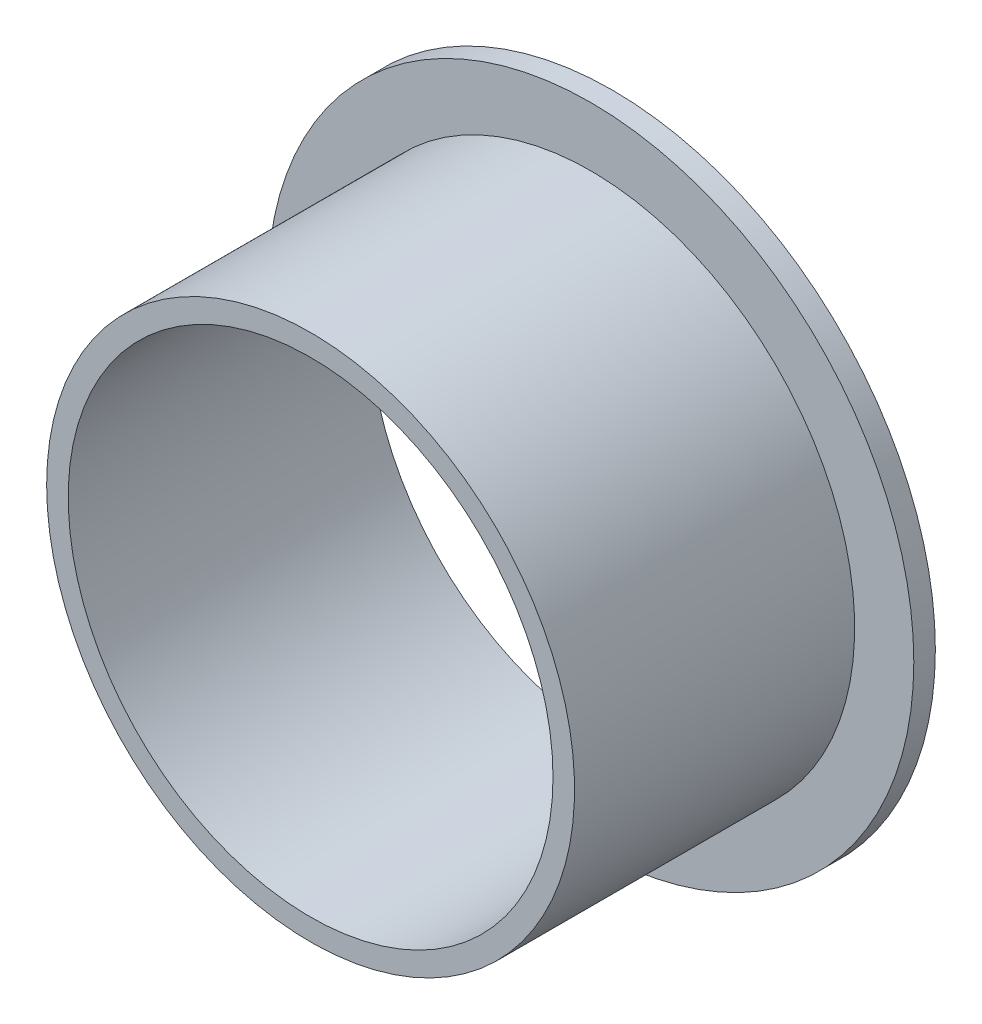
from build123d import *

# Parameters (mm, degrees)
SKETCH1_R           = 59.979684941
SKETCH1_R_2         = 45
BOSS_EXTRUDE1_DEPTH = 4
SKETCH2_R           = 49
SKETCH2_R_2         = 45
BOSS_EXTRUDE2_DEPTH = 52


with BuildPart() as part:
    # Sketch1 → Boss-Extrude1 (new body)
    with BuildSketch(Plane.XY):
        Circle(SKETCH1_R)
        Circle(SKETCH1_R_2, mode=Mode.SUBTRACT)
    extrude(amount=BOSS_EXTRUDE1_DEPTH)

    # Sketch2 → Boss-Extrude2 (add)
    with BuildSketch(Plane.XY.offset(4)):
        with Locations(Location((0, 0, 0), (0, 0, 180))):
            Circle(SKETCH2_R)
        Circle(SKETCH2_R_2, mode=Mode.SUBTRACT)
    extrude(amount=BOSS_EXTRUDE2_DEPTH)


solid = part.part
